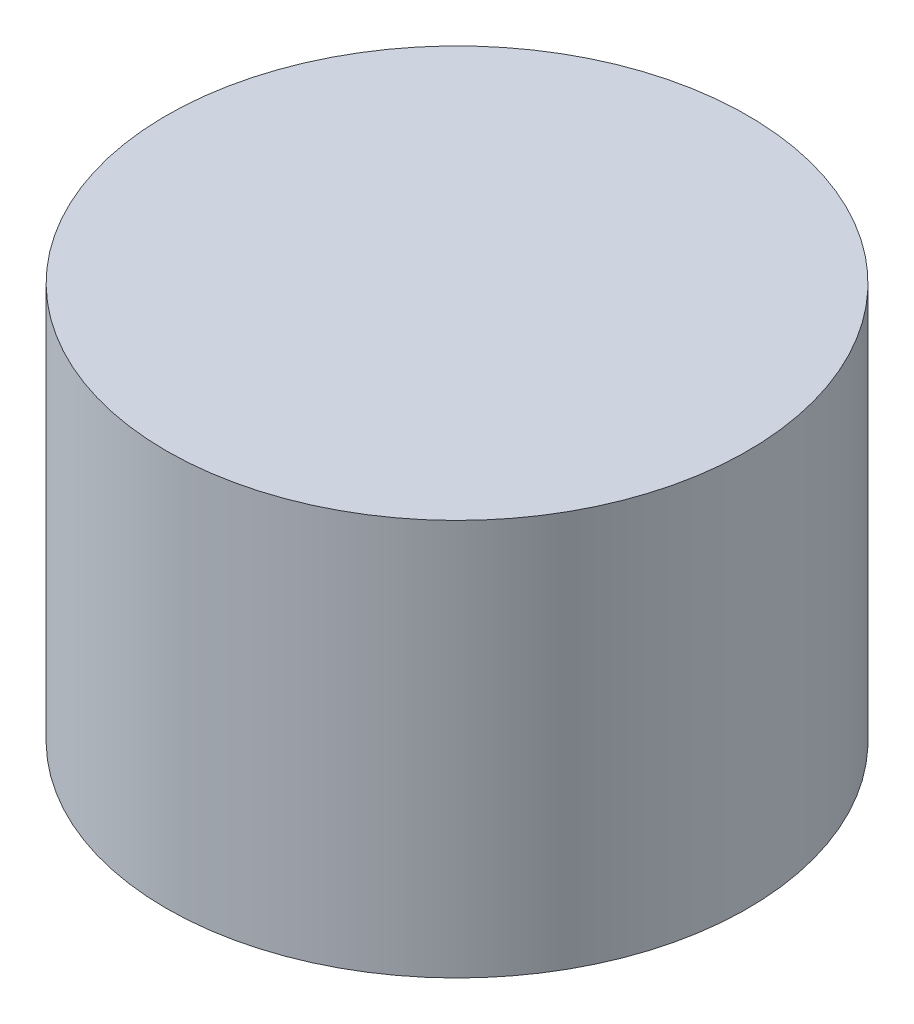
from build123d import *

# Parameters (mm, degrees)
SK_P01_SPEAKER44MM_R  = 22
P01_SPEAKER44MM_DEPTH = 30


with BuildPart() as part:
    # SK_P01_Speaker44mm → P01_Speaker44mm (new body)
    with BuildSketch(Plane(origin=(0, 0, 0), x_dir=(1, 0, 0), z_dir=(0, 1, 0))):
        with Locations(Location((0, 0, 0), (0, 0, 270))):
            Circle(SK_P01_SPEAKER44MM_R)
    extrude(amount=P01_SPEAKER44MM_DEPTH)


solid = part.part
